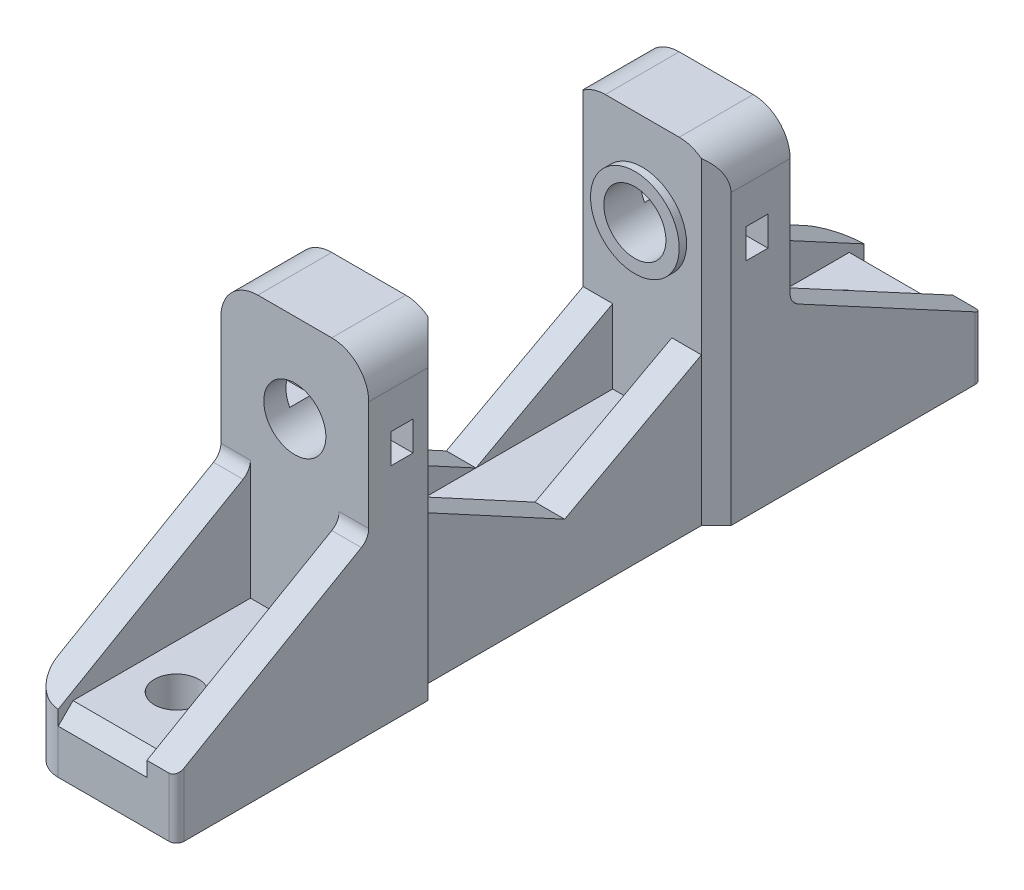
from build123d import *
from build123d.topology import SkipClean

# Parameters (mm, degrees)
SKETCH_1_W               = 20
SKETCH_1_H               = 44
SKETCH_1_R               = 4.2
EXTRUDE_1_DEPTH          = 7
SKETCH_2_W               = 20
SKETCH_2_H               = 44
EXTRUDE_2_DEPTH          = 3
SKETCH_3_W               = 20
SKETCH_3_H               = 26
SKETCH_3_R               = 3
EXTRUDE_4_DEPTH          = 8
EXTRUDE_5_DEPTH          = 4
EXTRUDE_6_DEPTH          = 4
CHAMFER_1_SIZE           = 2
FILLET_2_R               = 5
FILLET_3_R               = 1
FILLET_4_R               = 2
SKETCH_6_W               = 16
SKETCH_6_H               = 37
EXTRUDE_7_DEPTH          = 10
EXTRUDE_START            = 7
SKETCH_7_R               = 4.2
EXTRUDE_8_DEPTH          = 7
CHAMFER_2_SIZE           = 2
SKETCH_8_W               = 20
SKETCH_8_H               = 44
EXTRUDE_9_DEPTH          = 3
SKETCH_9_W               = 20
SKETCH_9_H               = 26
SKETCH_9_R               = 3
EXTRUDE_10_DEPTH         = 8
EXTRUDE_11_DEPTH         = 4
EXTRUDE_12_DEPTH         = 4
FILLET_5_R               = 2
FILLET_7_R               = 1
FILLET_8_R               = 5
SKETCH_12_W              = 3
SKETCH_12_H              = 4
CUT_EXTRUDE_1_DEPTH      = 88.549985722
EXTRUDE_13_DEPTH         = 4
EXTRUDE_14_DEPTH         = 4
CUT_EXTRUDE_2_DEPTH      = 86.819578186
CUT_EXTRUDE_2_DEPTH_BACK = 86.819578186
SKETCH_15_R              = 4.2
SKETCH_16_R              = 6
SKETCH_16_R_2            = 4.2
EXTRUDE_15_DEPTH         = 1
EXTRUDE_START_2          = 1
SKETCH_17_R              = 6
SKETCH_17_R_2            = 4.2
EXTRUDE_16_DEPTH         = 1
CHAMFER_3_SIZE           = 2
FILLET_9_R               = 4


with BuildPart() as part:
    # Эскиз1 → Бобышка-Вытянуть1 (new body)
    with BuildSketch(Plane.XY):
        with Locations((0, 22)):
            Rectangle(SKETCH_1_W, SKETCH_1_H)
        with Locations((0, 32)):
            Circle(SKETCH_1_R, mode=Mode.SUBTRACT)
    extrude(amount=EXTRUDE_1_DEPTH)

    # Эскиз2 → Бобышка-Вытянуть2 (add)
    with BuildSketch(Plane.XY.offset(7)):
        with Locations((0, 22)):
            Rectangle(SKETCH_2_W, SKETCH_2_H)
    extrude(amount=EXTRUDE_2_DEPTH)

    # Эскиз3 → Бобышка-Вытянуть4 (add)
    with BuildSketch(Plane(origin=(0, 0, 0), x_dir=(1, 0, 0), z_dir=(0, 1, 0))):
        with Locations((0, -23)):
            Rectangle(SKETCH_3_W, SKETCH_3_H)
        with Locations(Location((0, -26, 0), (0, 0, 270))):
            Circle(SKETCH_3_R, mode=Mode.SUBTRACT)
    extrude(amount=EXTRUDE_4_DEPTH)

    # Эскиз4 → Бобышка-Вытянуть5 (add)
    with BuildSketch(Plane.ZY.offset(10)):
        Polygon((36, 8), (10, 8), (10, 23), align=None)
    extrude(amount=-EXTRUDE_5_DEPTH)

    # Эскиз5 → Бобышка-Вытянуть6 (add)
    with BuildSketch(Plane(origin=(10, 0, 0), x_dir=(0, 0, -1), z_dir=(1, 0, 0))):
        Polygon((-36, 8), (-10, 23), (-10, 8), align=None)
    extrude(amount=-EXTRUDE_6_DEPTH)

    # Фаска1
    chamfer_1_edges = [part.edges().sort_by_distance(p)[0] for p in [
        (10, 22, 0),
        (-10, 22, 0),
    ]]
    chamfer(chamfer_1_edges, length=CHAMFER_1_SIZE)

    # Скругление2
    fillet_2_edges = [part.edges().sort_by_distance(p)[0] for p in [
        (-10, 44, 6),
        (10, 44, 6),
    ]]
    fillet(fillet_2_edges, radius=FILLET_2_R)

    # Скругление3
    fillet_3_edges = [part.edges().sort_by_distance(p)[0] for p in [
        (10, 4, 36),
    ]]
    fillet(fillet_3_edges, radius=FILLET_3_R)

    # Скругление4
    fillet_4_edges = [part.edges().sort_by_distance(p)[0] for p in [
        (-8, 23, 10),
        (8, 23, 10),
    ]]
    fillet(fillet_4_edges, radius=FILLET_4_R)

    # Эскиз6 → Бобышка-Вытянуть7 (add)
    with BuildSketch(Plane(origin=(0, 0, 0), x_dir=(1, 0, 0), z_dir=(0, 1, 0))):
        with Locations((0, 18.5)):
            Rectangle(SKETCH_6_W, SKETCH_6_H)
    extrude(amount=EXTRUDE_7_DEPTH)

    # Эскиз7 → Бобышка-Вытянуть8 (add)
    with BuildSketch(Plane(origin=(0, 0, -37), x_dir=(-1, 0, 0), z_dir=(0, 0, -1)).offset(EXTRUDE_START)):
        Polygon((0, 0), (-10, 0), (-10, 44), (10, 44), (10, 0), align=None)
        with Locations(Location((0, 32, 0), (0, 0, 180))):
            Circle(SKETCH_7_R, mode=Mode.SUBTRACT)
    extrude(amount=-EXTRUDE_8_DEPTH)

    # Фаска2
    chamfer_2_edges = [part.edges().sort_by_distance(p)[0] for p in [
        (10, 22, -37),
        (-10, 22, -37),
    ]]
    chamfer(chamfer_2_edges, length=CHAMFER_2_SIZE)

    # Эскиз8 → Бобышка-Вытянуть9 (add)
    with BuildSketch(Plane(origin=(0, 0, -44), x_dir=(-1, 0, 0), z_dir=(0, 0, -1))):
        with Locations((0, 22)):
            Rectangle(SKETCH_8_W, SKETCH_8_H)
    extrude(amount=EXTRUDE_9_DEPTH)

    # Эскиз9 → Бобышка-Вытянуть10 (add)
    with BuildSketch(Plane(origin=(0, 0, 0), x_dir=(1, 0, 0), z_dir=(0, 1, 0))):
        with Locations((0, 60)):
            Rectangle(SKETCH_9_W, SKETCH_9_H)
        with Locations(Location((0, 64, 0), (0, 0, 270))):
            Circle(SKETCH_9_R, mode=Mode.SUBTRACT)
    extrude(amount=EXTRUDE_10_DEPTH)

    # Эскиз10 → Бобышка-Вытянуть11 (add)
    with BuildSketch(Plane.ZY.offset(10)):
        Polygon((-73, 8), (-47, 8), (-47, 22), align=None)
    extrude(amount=-EXTRUDE_11_DEPTH)

    # Эскиз11 → Бобышка-Вытянуть12 (add)
    with BuildSketch(Plane(origin=(10, 0, 0), x_dir=(0, 0, -1), z_dir=(1, 0, 0))):
        Polygon((47, 8), (47, 22), (73, 8), align=None)
    extrude(amount=-EXTRUDE_12_DEPTH)

    # Скругление5
    fillet_5_edges = [part.edges().sort_by_distance(p)[0] for p in [
        (-8, 22, -47),
        (8, 22, -47),
    ]]
    fillet(fillet_5_edges, radius=FILLET_5_R)

    # Скругление7
    fillet_7_edges = [part.edges().sort_by_distance(p)[0] for p in [
        (10, 4, -73),
    ]]
    fillet(fillet_7_edges, radius=FILLET_7_R)

    # Скругление8
    fillet_8_edges = [part.edges().sort_by_distance(p)[0] for p in [
        (-10, 44, -43),
        (10, 44, -43),
    ]]
    fillet(fillet_8_edges, radius=FILLET_8_R)

    # Эскиз12 → Вырез-Вытянуть1 (cut, through all)
    with BuildSketch(Plane(origin=(10, 0, 0), x_dir=(0, 0, -1), z_dir=(1, 0, 0))):
        with Locations((-5.5, 32)):
            Rectangle(SKETCH_12_W, SKETCH_12_H)
        with Locations((42.5, 32)):
            Rectangle(SKETCH_12_W, SKETCH_12_H)
    extrude(amount=-CUT_EXTRUDE_1_DEPTH, mode=Mode.SUBTRACT)

    # Эскиз13 → Бобышка-Вытянуть13 (add)
    with BuildSketch(Plane(origin=(8, 0, 0), x_dir=(0, 0, -1), z_dir=(1, 0, 0))):
        Polygon((0, 10), (18.5, 10), (0, 20), align=None)
        Polygon((37, 10), (37, 20), (18.5, 10), align=None)
    extrude(amount=-EXTRUDE_13_DEPTH)

    # Эскиз14 → Бобышка-Вытянуть14 (add)
    with BuildSketch(Plane.ZY.offset(8)):
        Polygon((0, 10), (-18.5, 10), (0, 20), align=None)
        Polygon((-37, 10), (-37, 20), (-18.5, 10), align=None)
    extrude(amount=-EXTRUDE_14_DEPTH)

    # Эскиз15 → Вырез-Вытянуть2 (cut, two sides: drawn at the far end of the back side and taken through both)
    with SkipClean():  # the faces are left unmerged after this step: merging them gives an invalid solid
        with BuildSketch(Plane(origin=(0, 0, -37), x_dir=(-1, 0, 0), z_dir=(0, 0, -1)).offset(-CUT_EXTRUDE_2_DEPTH_BACK)):
            with Locations((0, 32)):
                Circle(SKETCH_15_R)
        extrude(amount=CUT_EXTRUDE_2_DEPTH + CUT_EXTRUDE_2_DEPTH_BACK, mode=Mode.SUBTRACT)

    # Эскиз16 → Бобышка-Вытянуть15 (add)
    with SkipClean():  # the faces are left unmerged after this step: merging them gives an invalid solid
        with BuildSketch(Plane(origin=(0, 0, -37), x_dir=(-1, 0, 0), z_dir=(0, 0, -1))):
            with Locations((0, 32)):
                Circle(SKETCH_16_R)
            with Locations((0, 32)):
                Circle(SKETCH_16_R_2, mode=Mode.SUBTRACT)
        extrude(amount=-EXTRUDE_15_DEPTH)

    # Эскиз17 → Бобышка-Вытянуть16 (add)
    with SkipClean():  # the faces are left unmerged after this step: merging them gives an invalid solid
        with BuildSketch(Plane(origin=(0, 0, 0), x_dir=(-1, 0, 0), z_dir=(0, 0, -1)).offset(EXTRUDE_START_2)):
            with Locations((0, 32)):
                Circle(SKETCH_17_R)
            with Locations((0, 32)):
                Circle(SKETCH_17_R_2, mode=Mode.SUBTRACT)
        extrude(amount=-EXTRUDE_16_DEPTH)

    # Фаска3
    chamfer_3_edges = [part.edges().sort_by_distance(p)[0] for p in [
        (0, 8, -73),
        (0, 8, 36),
    ]]
    chamfer(chamfer_3_edges, length=CHAMFER_3_SIZE)

    # Скругление9
    fillet_9_edges = [part.edges().sort_by_distance(p)[0] for p in [
        (-10, 4, 36),
        (-10, 4, -73),
    ]]
    fillet(fillet_9_edges, radius=FILLET_9_R)


solid = part.part
